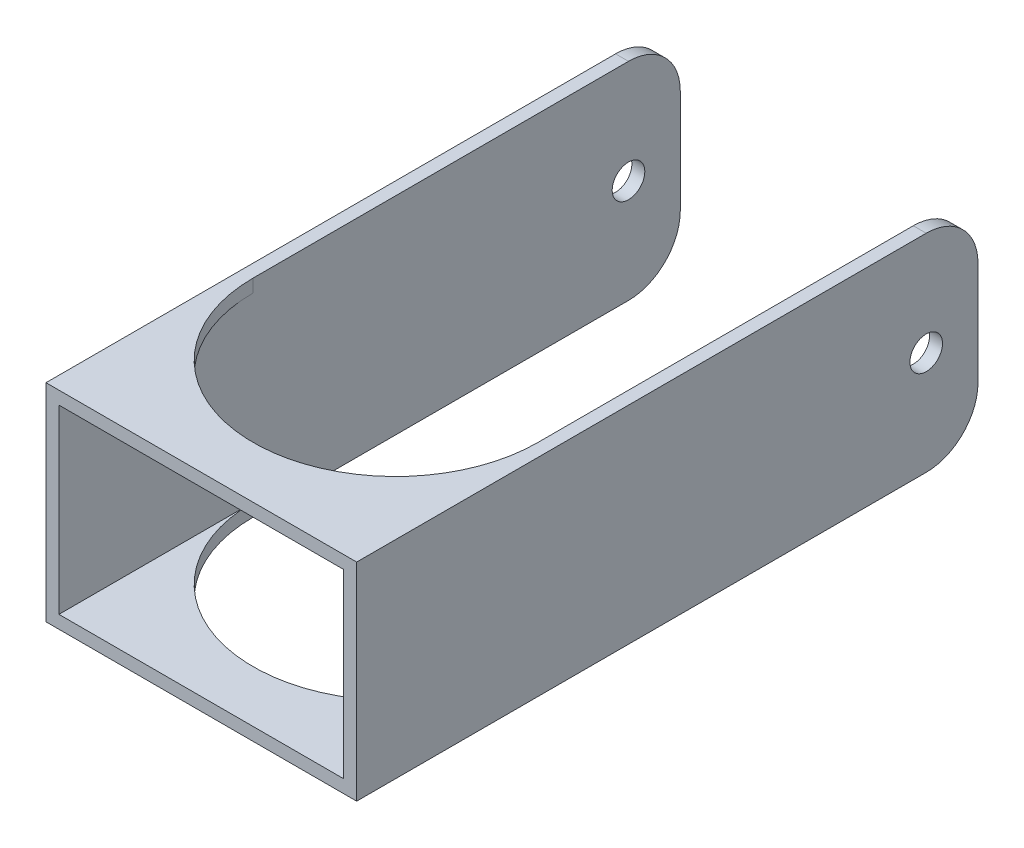
from build123d import *

# Parameters (mm, degrees)
BOSS_EXTRUDE1_DEPTH      = 76.2
BOSS_EXTRUDE1_DEPTH_BACK = 76.2
SKETCH3_W                = 76.2
SKETCH3_H                = 50.8
SKETCH3_W_2              = 69.85
SKETCH3_H_2              = 44.45
CUT_EXTRUDE1_DEPTH       = 100.190170884
CUT_EXTRUDE1_DEPTH_BACK  = 100.190170884
SKETCH7_R                = 4
CUT_EXTRUDE2_DEPTH       = 111.716033166
FILLET1_R                = 12.7


with BuildPart() as part:
    # Sketch3 → Boss-Extrude1 (new, two sides: drawn at the far end of the back side and taken through both)
    with BuildSketch(Plane.XY.offset(-BOSS_EXTRUDE1_DEPTH_BACK)):
        Rectangle(SKETCH3_W, SKETCH3_H)
        Rectangle(SKETCH3_W_2, SKETCH3_H_2, mode=Mode.SUBTRACT)
    extrude(amount=BOSS_EXTRUDE1_DEPTH + BOSS_EXTRUDE1_DEPTH_BACK)

    # Sketch6 → Cut-Extrude1 (cut, two sides: drawn at the far end of the back side and taken through both)
    with BuildSketch(Plane(origin=(0, 25.4, 0), x_dir=(1, 0, 0), z_dir=(0, 1, 0)).offset(-CUT_EXTRUDE1_DEPTH_BACK)):
        with BuildLine():
            Line((34.925, 76.2), (-34.925, 76.2))
            Line((-34.925, 76.2), (-34.925, -28.575))
            ThreePointArc((-34.925, -28.575), (0, -63.5), (34.925, -28.575))
            Line((34.925, -28.575), (34.925, 76.2))
        make_face()
    extrude(amount=CUT_EXTRUDE1_DEPTH + CUT_EXTRUDE1_DEPTH_BACK, mode=Mode.SUBTRACT)

    # Sketch7 → Cut-Extrude2 (cut, through all)
    with BuildSketch(Plane(origin=(38.1, 0, 0), x_dir=(0, 0, -1), z_dir=(1, 0, 0))):
        with Locations((63.5, 0)):
            Circle(SKETCH7_R)
    extrude(amount=-CUT_EXTRUDE2_DEPTH, mode=Mode.SUBTRACT)

    # Fillet1
    fillet1_edges = [part.edges().sort_by_distance(p)[0] for p in [
        (36.5125, 25.4, -76.2),
        (-36.5125, -25.4, -76.2),
        (-36.5125, 25.4, -76.2),
        (36.5125, -25.4, -76.2),
    ]]
    fillet(fillet1_edges, radius=FILLET1_R)


solid = part.part
